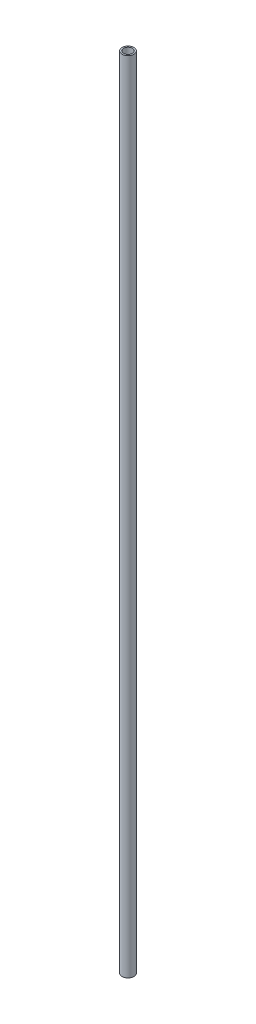
from build123d import *

# Parameters (mm, degrees)
SKETCH2_R   = 4
SKETCH2_R_2 = 3


with BuildPart() as part:
    # Sweep1: sweep along a path in Sketch1
    with BuildLine(Plane.XY) as sweep1_path:
        Line((0, 0), (0, 540))
    # Sketch2 → Sweep1 (sweep)
    with BuildSketch(Plane(origin=(0, 0, 0), x_dir=(1, 0, 0), z_dir=(0, 1, 0))):
        Circle(SKETCH2_R)
        Circle(SKETCH2_R_2, mode=Mode.SUBTRACT)
    sweep(path=sweep1_path.line)


solid = part.part
